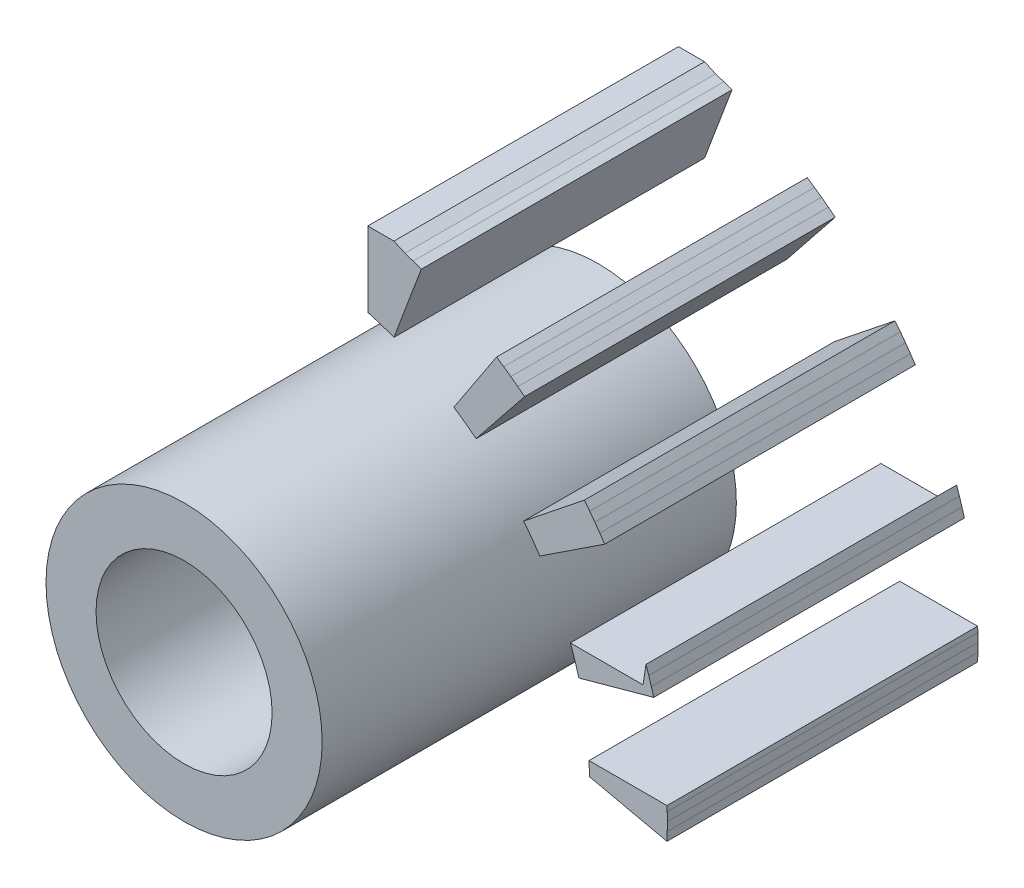
from build123d import *

# Parameters (mm, degrees)
SKETCH_1_R      = 8
SKETCH_1_R_2    = 5.1
EXTRUDE_1_DEPTH = 24
SKETCH_1_2_R    = 8
SKETCH_1_2_R_2  = 5.1
EXTRUDE_2_DEPTH = 24
EXTRUDE_3_DEPTH = 18
EXTRUDE_4_DEPTH = 18
EXTRUDE_5_DEPTH = 18
EXTRUDE_6_DEPTH = 18
EXTRUDE_7_DEPTH = 18


with BuildPart() as part:
    # 草图1 → 凸台-拉伸1 (new body)
    with BuildSketch(Plane.XY):
        Circle(SKETCH_1_R)
        Circle(SKETCH_1_R_2, mode=Mode.SUBTRACT)
    extrude(amount=EXTRUDE_1_DEPTH)

    # 草图1<2> → 凸台-拉伸2 (add)
    with BuildSketch(Plane.XY):
        Circle(SKETCH_1_2_R)
        Circle(SKETCH_1_2_R_2, mode=Mode.SUBTRACT)
    extrude(amount=EXTRUDE_2_DEPTH)


with BuildPart() as body_2:
    # 草图2 → 凸台-拉伸3 (new body)
    with BuildSketch(Plane.XY):
        with BuildLine():
            Line((17.463711136, 0.796076784), (21.977178019, 0.796076784))
            Line((21.977178019, 0.796076784), (21.994293765, 0.501040705))
            Line((21.994293765, 0.501040705), (22, 0))
            Line((22, 0), (21.994293765, -0.501040705))
            Line((21.994293765, -0.501040705), (21.977178019, -1.001821495))
            Line((21.977178019, -1.001821495), (17.481846152, 0))
            ThreePointArc((17.481846152, 0), (17.47731181, 0.39814166), (17.463711136, 0.796076784))
        make_face()
    extrude(amount=EXTRUDE_3_DEPTH)


with BuildPart() as body_3:
    # 草图3 → 凸台-拉伸4 (new body)
    with BuildSketch(Plane.XY):
        with BuildLine():
            Line((16.379966987, 6.160087784), (20.591958498, 6.160087784))
            Line((20.591958498, 6.160087784), (20.762986314, 7.27312858))
            Line((20.762986314, 7.27312858), (20.923243358, 6.798373876))
            Line((20.923243358, 6.798373876), (21.072646499, 6.320092525))
            Line((21.072646499, 6.320092525), (21.211118232, 5.838532635))
            Line((21.211118232, 5.838532635), (16.872480412, 4.644287323))
            ThreePointArc((16.872480412, 4.644287323), (16.643489035, 5.407797402), (16.379966987, 6.160087784))
        make_face()
    extrude(amount=EXTRUDE_4_DEPTH)


with BuildPart() as body_4:
    # 草图4 → 凸台-拉伸5 (new body)
    with BuildSketch(Plane.XY):
        with BuildLine():
            Line((13.674702527, 10.920279795), (17.191054606, 13.728351742))
            Line((17.191054606, 13.728351742), (17.499253098, 13.333271955))
            Line((17.499253098, 13.333271955), (17.798373876, 12.93127555))
            Line((17.798373876, 12.93127555), (18.088261772, 12.522571065))
            Line((18.088261772, 12.522571065), (18.368766406, 12.107370512))
            Line((18.368766406, 12.107370512), (14.611518732, 9.630862907))
            ThreePointArc((14.611518732, 9.630862907), (14.157797402, 10.286241915), (13.674702527, 10.920279795))
        make_face()
    extrude(amount=EXTRUDE_5_DEPTH)


with BuildPart() as body_5:
    # 草图5 → 凸台-拉伸6 (new body)
    with BuildSketch(Plane.XY):
        with BuildLine():
            Line((9.630862907, 14.611518732), (12.107370512, 18.368766406))
            Line((12.107370512, 18.368766406), (12.522571065, 18.088261772))
            Line((12.522571065, 18.088261772), (12.93127555, 17.798373876))
            Line((12.93127555, 17.798373876), (13.333271955, 17.499253098))
            Line((13.333271955, 17.499253098), (13.728351742, 17.191054606))
            Line((13.728351742, 17.191054606), (10.920279795, 13.674702527))
            ThreePointArc((10.920279795, 13.674702527), (10.286241915, 14.157797402), (9.630862907, 14.611518732))
        make_face()
    extrude(amount=EXTRUDE_6_DEPTH)


with BuildPart() as body_6:
    # 草图6 → 凸台-拉伸7 (new body)
    with BuildSketch(Plane.XY):
        with BuildLine():
            Line((4.644287323, 16.872480412), (4.644287323, 21.211118232))
            Line((4.644287323, 21.211118232), (6.160087784, 21.211118232))
            Line((6.160087784, 21.211118232), (6.798373876, 20.923243358))
            Line((6.798373876, 20.923243358), (7.27312858, 20.762986314))
            Line((7.27312858, 20.762986314), (7.744110358, 20.591958498))
            Line((7.744110358, 20.591958498), (6.160087784, 16.379966987))
            ThreePointArc((6.160087784, 16.379966987), (5.407797402, 16.643489035), (4.644287323, 16.872480412))
        make_face()
    extrude(amount=EXTRUDE_7_DEPTH)


solid = Compound([part.part, body_2.part, body_3.part, body_4.part, body_5.part, body_6.part])
